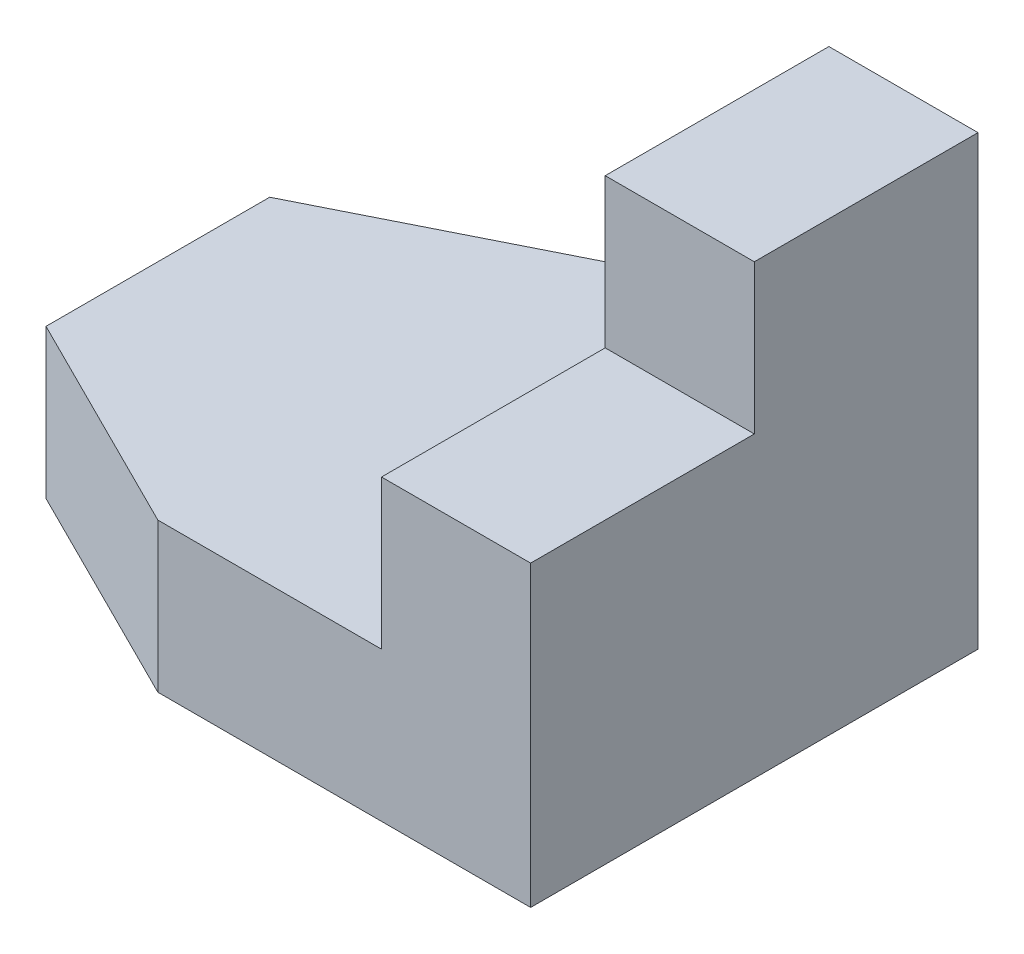
from build123d import *

# Parameters (mm, degrees)
Y_KSEKLIK_EKSTR_ZYON1_DEPTH = 15
KES_EKSTR_ZYON1_DEPTH       = 10
IZIM4_W                     = 15
IZIM4_H                     = 10
KES_EKSTR_ZYON2_DEPTH       = 10


with BuildPart() as part:
    # Çizim2 → Yükseklik-Ekstrüzyon1 (new, symmetric)
    with BuildSketch(Plane.XY):
        Polygon((0, 0), (0, 30), (-10, 30), (-10, 10), (-40, 10), (-40, 0), align=None)
    extrude(amount=Y_KSEKLIK_EKSTR_ZYON1_DEPTH, both=True)

    # Çizim3 → Kes-Ekstrüzyon1 (cut)
    with BuildSketch(Plane(origin=(0, 0, 0), x_dir=(1, 0, 0), z_dir=(0, 1, 0))):
        Polygon((-40, 15), (-25, 15), (-40, 7.5), align=None)
        Polygon((-25, -15), (-40, -7.5), (-40, -15), align=None)
    extrude(amount=KES_EKSTR_ZYON1_DEPTH, mode=Mode.SUBTRACT)

    # Çizim4 → Kes-Ekstrüzyon2 (cut)
    with BuildSketch(Plane.ZY.offset(10)):
        with Locations((7.5, 25)):
            Rectangle(IZIM4_W, IZIM4_H)
    extrude(amount=-KES_EKSTR_ZYON2_DEPTH, mode=Mode.SUBTRACT)


solid = part.part
